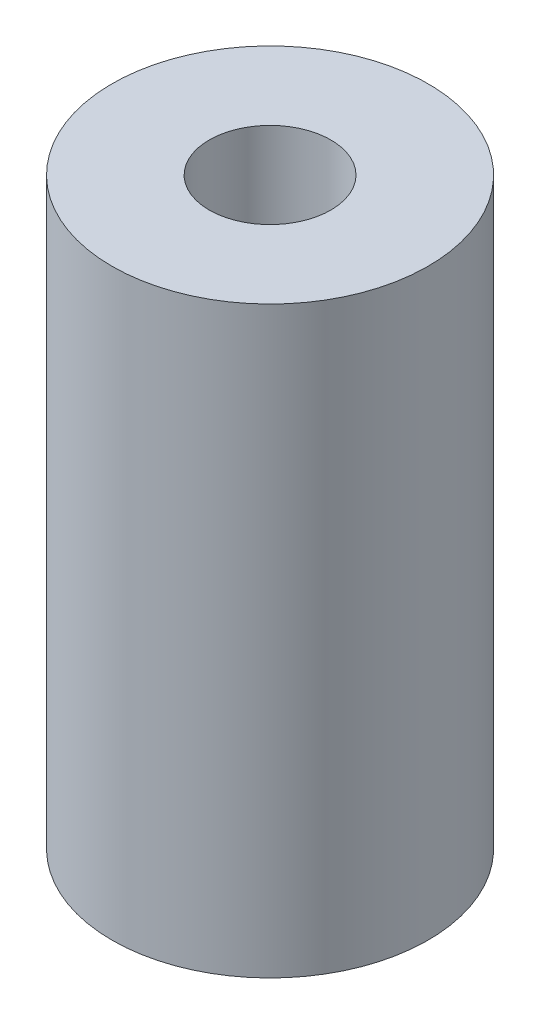
from build123d import *

# Parameters (mm, degrees)
SKETCH2_R               = 1.3
SKETCH2_R_2             = 0.5
BOSS_EXTRUDE1_DEPTH     = 4.8
CUT_EXTRUDE1_DEPTH      = 0.05
CUT_EXTRUDE1_DEPTH_BACK = 0.05
SKETCH3_R               = 0.6
SKETCH3_R_2             = 0.5


with BuildPart() as part:
    # Sketch2 → Boss-Extrude1 (new body)
    with BuildSketch(Plane(origin=(0, 0, 0), x_dir=(1, 0, 0), z_dir=(0, 1, 0))):
        with Locations(Location((0, 0, 0), (0, 0, 270))):
            Circle(SKETCH2_R)
        with Locations(Location((0, 0, 0), (0, 0, 270))):
            Circle(SKETCH2_R_2, mode=Mode.SUBTRACT)
    extrude(amount=BOSS_EXTRUDE1_DEPTH)

    # Sketch3 → Cut-Extrude1 (cut, two sides: drawn at the far end of the back side and taken through both)
    with BuildSketch(Plane(origin=(0, 2.4, 0), x_dir=(1, 0, 0), z_dir=(0, 1, 0)).offset(-CUT_EXTRUDE1_DEPTH_BACK)):
        with Locations(Location((0, 0, 0), (0, 0, 270))):
            Circle(SKETCH3_R)
        with Locations(Location((0, 0, 0), (0, 0, 270))):
            Circle(SKETCH3_R_2, mode=Mode.SUBTRACT)
    extrude(amount=CUT_EXTRUDE1_DEPTH + CUT_EXTRUDE1_DEPTH_BACK, mode=Mode.SUBTRACT)


solid = part.part
